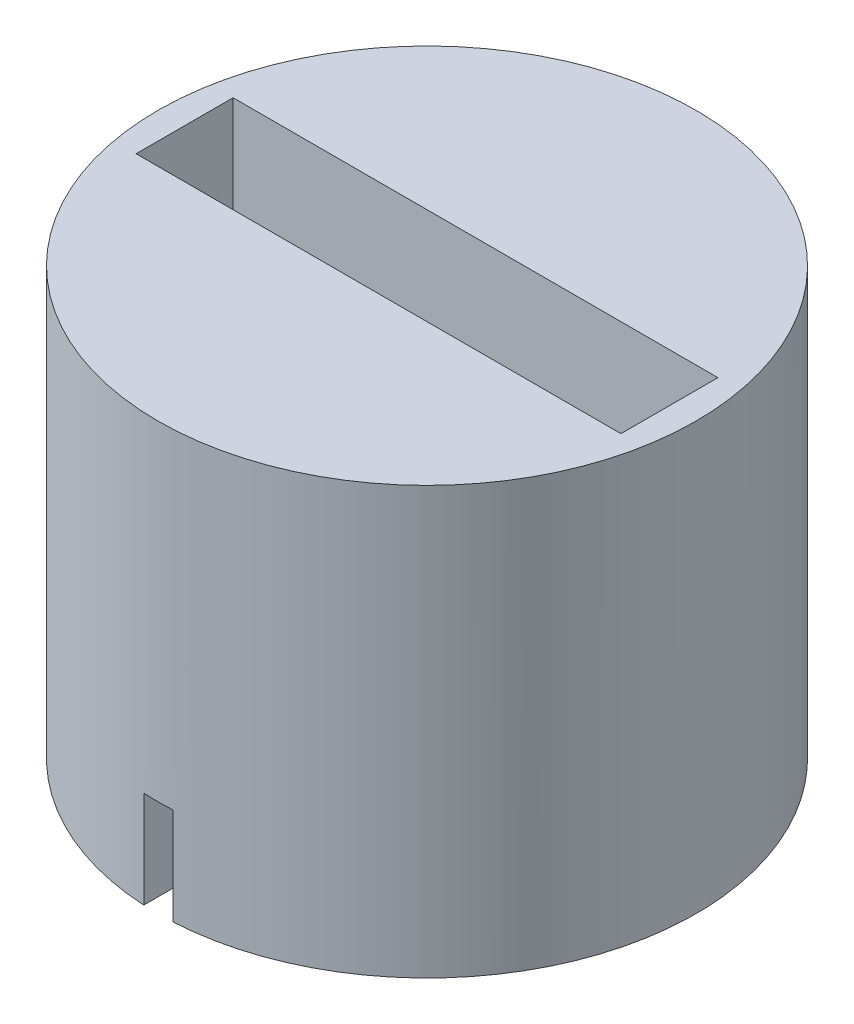
from build123d import *

# Parameters (mm, degrees)
SKETCH1_R           = 13.875
BOSS_EXTRUDE1_DEPTH = 22
SKETCH2_W           = 1.5
SKETCH2_H           = 2.924695476
SKETCH2_H_2         = 4.466803309
CUT_EXTRUDE1_DEPTH  = 5
SKETCH3_W           = 25
SKETCH3_H           = 5
CUT_EXTRUDE2_DEPTH  = 20


with BuildPart() as part:
    # Sketch1 → Boss-Extrude1 (new body)
    with BuildSketch(Plane(origin=(0, 0, 0), x_dir=(1, 0, 0), z_dir=(0, 1, 0))):
        with Locations(Location((0, 0, 0), (0, 0, 270))):
            Circle(SKETCH1_R)
    extrude(amount=BOSS_EXTRUDE1_DEPTH)

    # Sketch2 → Cut-Extrude1 (cut)
    with BuildSketch(Plane.XZ):
        with Locations((0, 13.462347738)):
            Rectangle(SKETCH2_W, SKETCH2_H)
        with Locations((0, -14.233401654)):
            Rectangle(SKETCH2_W, SKETCH2_H_2)
    extrude(amount=-CUT_EXTRUDE1_DEPTH, mode=Mode.SUBTRACT)

    # Sketch3 → Cut-Extrude2 (cut)
    with BuildSketch(Plane(origin=(0, 22, 0), x_dir=(1, 0, 0), z_dir=(0, 1, 0))):
        Rectangle(SKETCH3_W, SKETCH3_H)
    extrude(amount=-CUT_EXTRUDE2_DEPTH, mode=Mode.SUBTRACT)


solid = part.part
